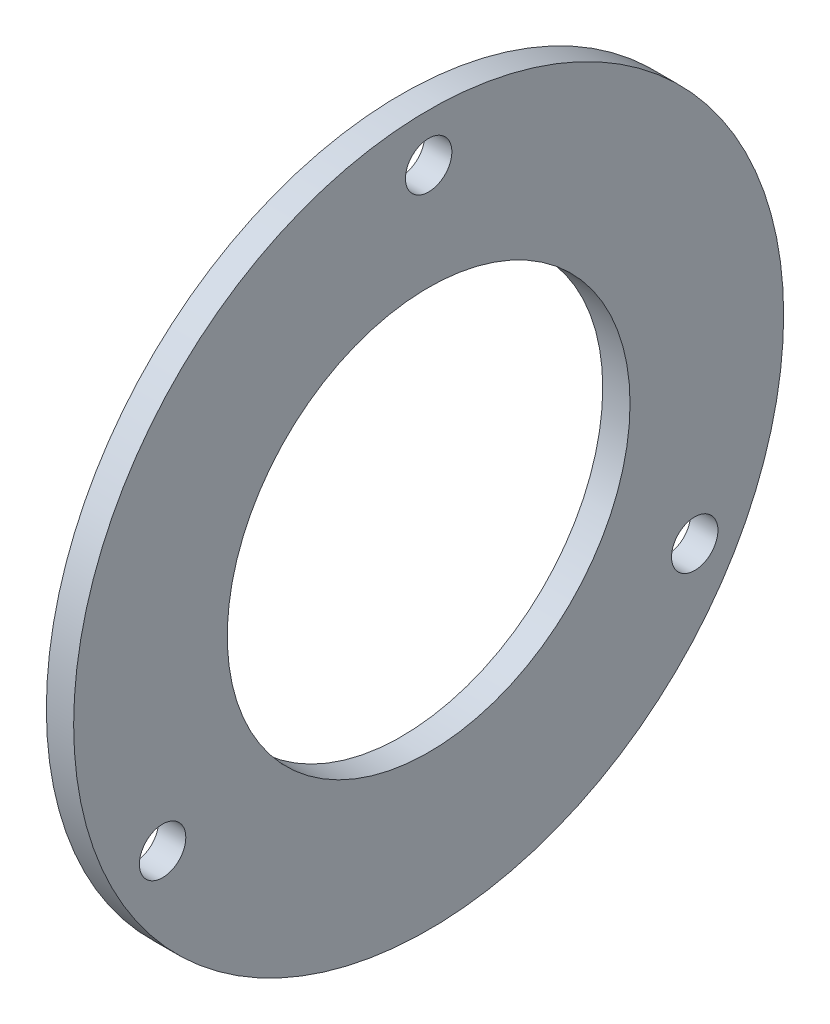
from build123d import *

# Parameters (mm, degrees)
SKETCH1_R           = 26
BOSS_EXTRUDE1_DEPTH = 2
SKETCH2_R           = 14.75
CUT_EXTRUDE1_DEPTH  = 37.823905279
SKETCH3_R           = 1.7
CUT_EXTRUDE2_DEPTH  = 37.823905279


with BuildPart() as part:
    # Sketch1 → Boss-Extrude1 (new body)
    with BuildSketch(Plane.YZ):
        with Locations(Location((0, 0, 0), (0, 0, 270))):
            Circle(SKETCH1_R)
    extrude(amount=BOSS_EXTRUDE1_DEPTH)

    # Sketch2 → Cut-Extrude1 (cut, through all)
    with BuildSketch(Plane.YZ.offset(2)):
        with Locations(Location((0, 0, 0), (0, 0, 270))):
            Circle(SKETCH2_R)
    extrude(amount=-CUT_EXTRUDE1_DEPTH, mode=Mode.SUBTRACT)

    # Sketch3 → Cut-Extrude2 (cut, through all)
    with BuildSketch(Plane.YZ.offset(2)):
        with Locations(Location((22.5, 0, 0), (0, 0, 270))):
            Circle(SKETCH3_R)
        with Locations(Location((-11.25, -19.485571585, 0), (0, 0, 270))):
            Circle(SKETCH3_R)
        with Locations(Location((-11.25, 19.485571585, 0), (0, 0, 270))):
            Circle(SKETCH3_R)
    extrude(amount=-CUT_EXTRUDE2_DEPTH, mode=Mode.SUBTRACT)


solid = part.part
